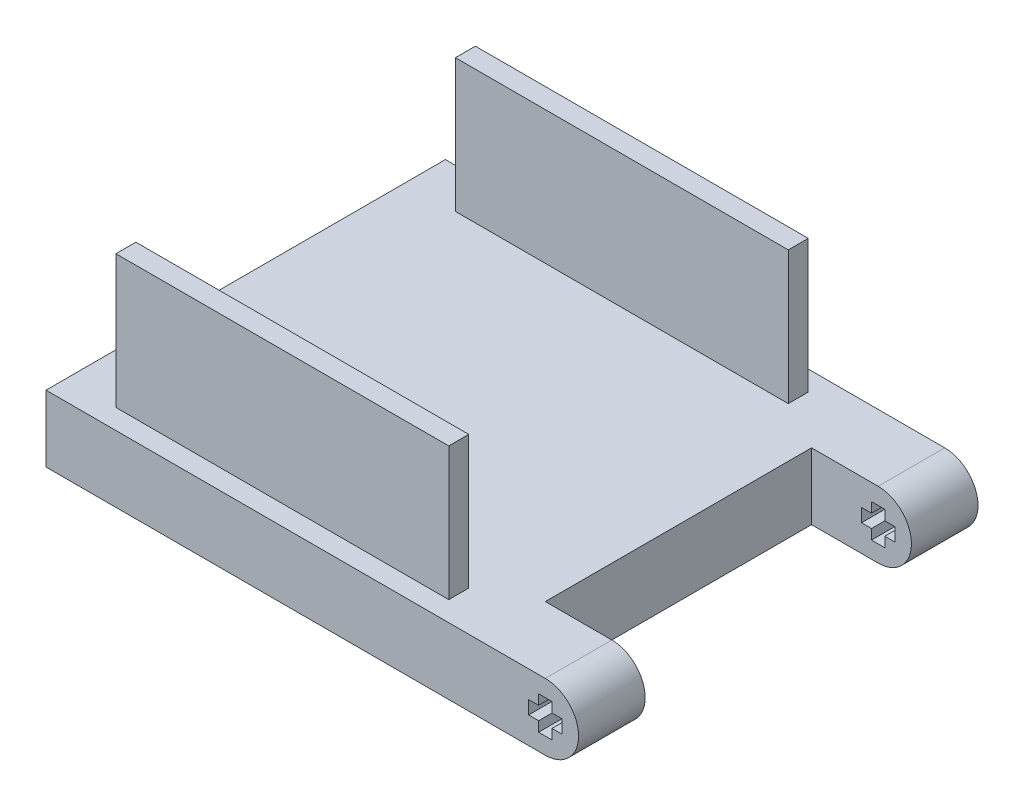
from build123d import *

# Parameters (mm, degrees)
SKETCH1_W               = 65
SKETCH1_H               = 60
BOSS_EXTRUDE1_DEPTH     = 10
BOSS_EXTRUDE2_DEPTH     = 10
BOSS_EXTRUDE3_START     = -10
BOSS_EXTRUDE3_DEPTH     = 10
CUT_EXTRUDE1_DEPTH      = 101.498756211
CUT_EXTRUDE1_DEPTH_BACK = 101.498756211
SKETCH7_W               = 1.5
SKETCH7_H               = 2
SKETCH7_W_2             = 2
SKETCH7_H_2             = 1.5
SKETCH8_W               = 50
SKETCH8_H               = 3
BOSS_EXTRUDE4_DEPTH     = 20


with BuildPart() as part:
    # Sketch1 → Boss-Extrude1 (new body)
    with BuildSketch(Plane(origin=(0, 0, 0), x_dir=(1, 0, 0), z_dir=(0, 1, 0))):
        with Locations((32.5, 30)):
            Rectangle(SKETCH1_W, SKETCH1_H)
    extrude(amount=BOSS_EXTRUDE1_DEPTH)

    # Sketch2 → Boss-Extrude2 (add)
    with BuildSketch(Plane(origin=(0, 0, -60), x_dir=(-1, 0, 0), z_dir=(0, 0, -1))):
        with BuildLine():
            Line((-65, 10), (-75, 10))
            ThreePointArc((-75, 10), (-80, 5), (-75, 0))
            Line((-75, 0), (-65, 0))
            Line((-65, 0), (-65, 10))
        make_face()
    extrude(amount=-BOSS_EXTRUDE2_DEPTH)

    # Sketch6 → Boss-Extrude3 (add)
    with BuildSketch(Plane.XY.offset(BOSS_EXTRUDE3_START)):
        with BuildLine():
            Line((65, 10), (75, 10))
            ThreePointArc((75, 10), (80, 5), (75, 0))
            Line((75, 0), (65, 0))
            Line((65, 0), (65, 10))
        make_face()
    extrude(amount=BOSS_EXTRUDE3_DEPTH)

    # Sketch7 → Cut-Extrude1 (cut, two sides: drawn at the far end of the back side and taken through both)
    with BuildSketch(Plane.XY.offset(-CUT_EXTRUDE1_DEPTH_BACK)):
        with Locations((76.75, 5)):
            Rectangle(SKETCH7_W, SKETCH7_H)
        with Locations((75, 6.75)):
            Rectangle(SKETCH7_W_2, SKETCH7_H_2)
        with Locations((75, 5)):
            Rectangle(SKETCH7_W_2, SKETCH7_H)
        with Locations((73.25, 5)):
            Rectangle(SKETCH7_W, SKETCH7_H)
        with Locations((75, 3.25)):
            Rectangle(SKETCH7_W_2, SKETCH7_H_2)
    extrude(amount=CUT_EXTRUDE1_DEPTH + CUT_EXTRUDE1_DEPTH_BACK, mode=Mode.SUBTRACT)

    # Sketch8 → Boss-Extrude4 (add)
    with BuildSketch(Plane(origin=(0, 10, 0), x_dir=(1, 0, 0), z_dir=(0, 1, 0))):
        with Locations((32.5, 4.5)):
            Rectangle(SKETCH8_W, SKETCH8_H)
        with Locations((32.5, 55.5)):
            Rectangle(SKETCH8_W, SKETCH8_H)
    extrude(amount=BOSS_EXTRUDE4_DEPTH)


solid = part.part
